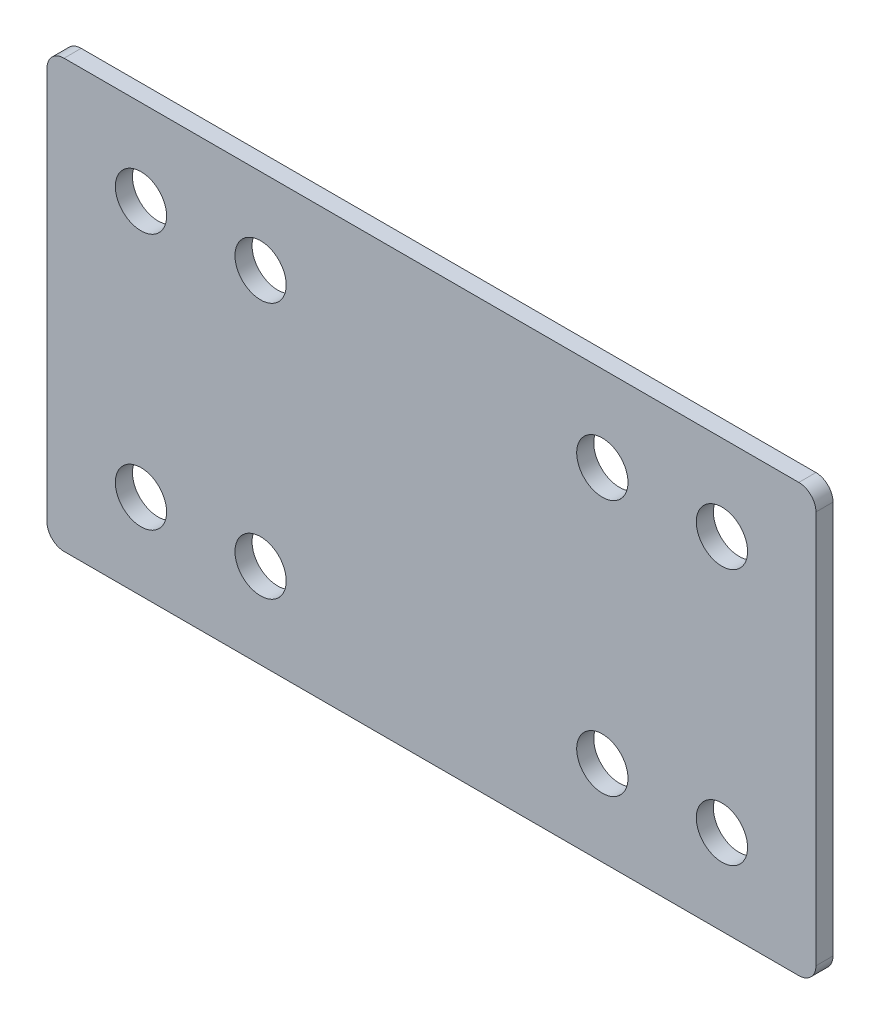
from build123d import *

# Parameters (mm, degrees)
SKETCH1_W           = 45
SKETCH1_H           = 25
BOSS_EXTRUDE1_DEPTH = 1
SKETCH2_R           = 1.5
CUT_EXTRUDE1_DEPTH  = 26.758493745
FILLET1_R           = 1


with BuildPart() as part:
    # Sketch1 → Boss-Extrude1 (new body)
    with BuildSketch(Plane.XY):
        Rectangle(SKETCH1_W, SKETCH1_H)
    extrude(amount=BOSS_EXTRUDE1_DEPTH)

    # Sketch2 → Cut-Extrude1 (cut, through all)
    with BuildSketch(Plane.XY.offset(1)):
        with Locations((17, 7.5)):
            Circle(SKETCH2_R)
        with Locations((10, 7.5)):
            Circle(SKETCH2_R)
        with Locations((-17, 7.5)):
            Circle(SKETCH2_R)
        with Locations((-10, 7.5)):
            Circle(SKETCH2_R)
        with Locations((17, -7.5)):
            Circle(SKETCH2_R)
        with Locations((10, -7.5)):
            Circle(SKETCH2_R)
        with Locations((-17, -7.5)):
            Circle(SKETCH2_R)
        with Locations((-10, -7.5)):
            Circle(SKETCH2_R)
    extrude(amount=-CUT_EXTRUDE1_DEPTH, mode=Mode.SUBTRACT)

    # Fillet1
    fillet1_edges = [part.edges().sort_by_distance(p)[0] for p in [
        (22.5, -12.5, 0.5),
        (-22.5, -12.5, 0.5),
        (-22.5, 12.5, 0.5),
        (22.5, 12.5, 0.5),
    ]]
    fillet(fillet1_edges, radius=FILLET1_R)


solid = part.part
